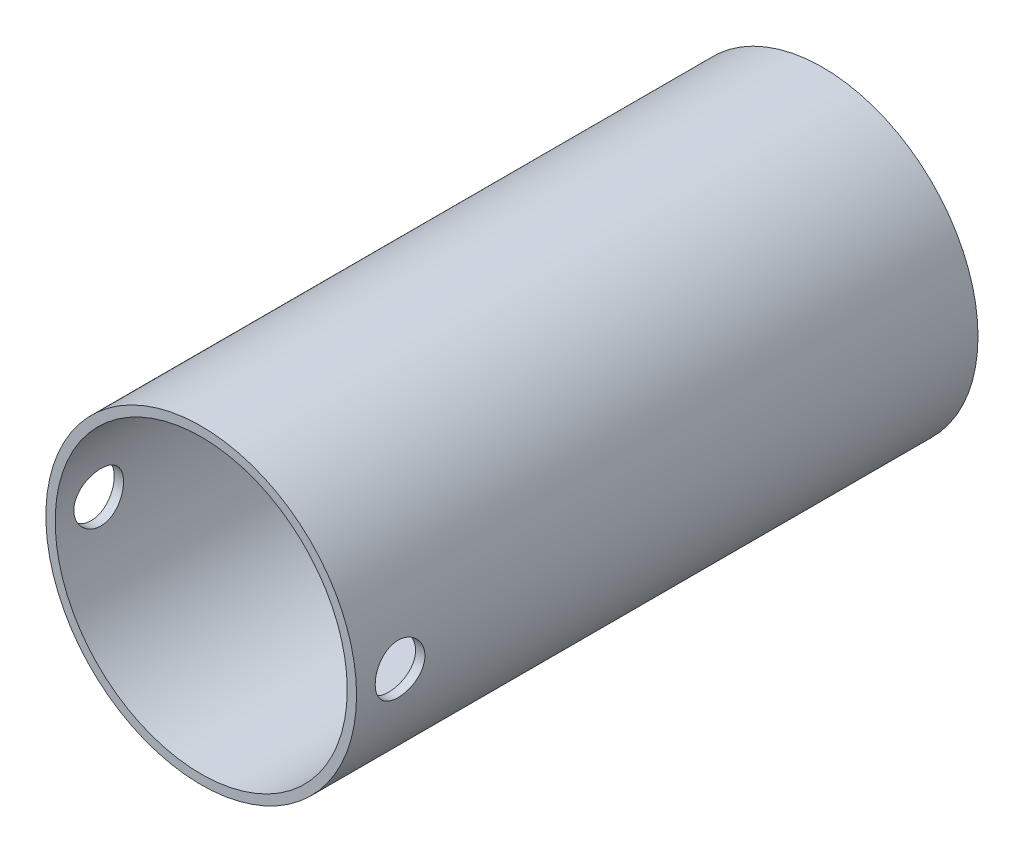
from build123d import *

# Parameters (mm, degrees)
CROQUIS1_R                 = 25
CROQUIS1_R_2               = 23.5
SALIENTE_EXTRUIR1_DEPTH    = 100
CORTAR_EXTRUIR1_DEPTH      = 107.066017178
CORTAR_EXTRUIR1_DEPTH_BACK = 107.066017178
CROQUIS2_R                 = 4


with BuildPart() as part:
    # Croquis1 → Saliente-Extruir1 (new body)
    with BuildSketch(Plane.XY):
        Circle(CROQUIS1_R)
        Circle(CROQUIS1_R_2, mode=Mode.SUBTRACT)
    extrude(amount=SALIENTE_EXTRUIR1_DEPTH)

    # Croquis2 → Cortar-Extruir1 (cut, two sides: drawn at the far end of the back side and taken through both)
    with BuildSketch(Plane(origin=(0, 0, 0), x_dir=(0, 0, -1), z_dir=(1, 0, 0)).offset(-CORTAR_EXTRUIR1_DEPTH_BACK)):
        with Locations((-93, 0)):
            Circle(CROQUIS2_R)
    extrude(amount=CORTAR_EXTRUIR1_DEPTH + CORTAR_EXTRUIR1_DEPTH_BACK, mode=Mode.SUBTRACT)


solid = part.part
